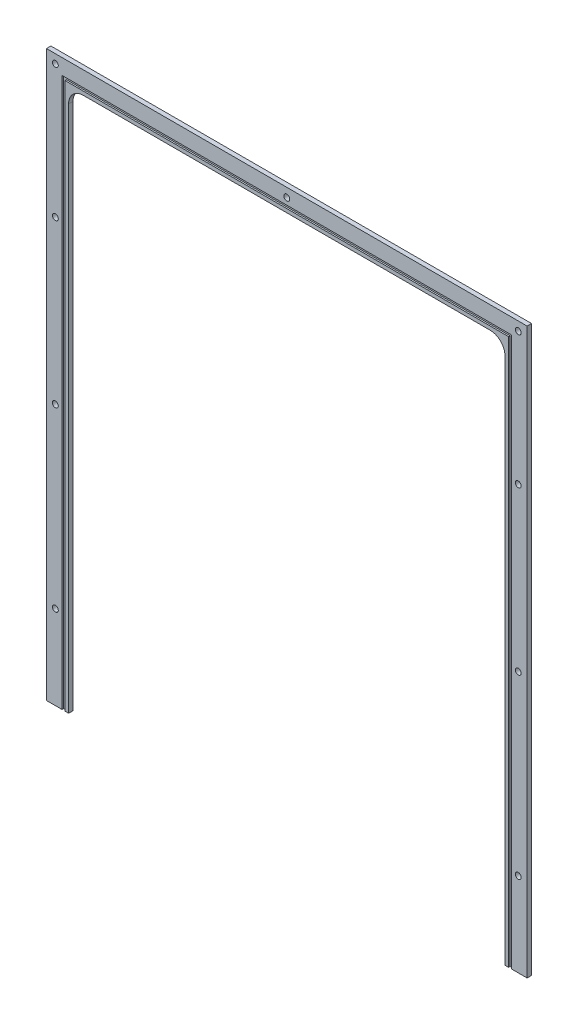
from build123d import *

# Parameters (mm, degrees)
SKETCH1_R           = 2
BOSS_EXTRUDE1_DEPTH = 3
GROOVE_DEPTH        = 1


with BuildPart() as part:
    # Sketch1 → Boss-Extrude1 (new body)
    with BuildSketch(Plane.XY):
        with BuildLine():
            Line((163, 193), (-163, 193))
            Line((-163, 193), (-163, -190))
            Line((-163, -190), (-148, -190))
            Line((-148, -190), (-148, -173))
            Line((-148, -173), (-148, 168))
            ThreePointArc((-148, 168), (-145.071067812, 175.071067812), (-138, 178))
            Line((-138, 178), (138, 178))
            ThreePointArc((138, 178), (145.071067812, 175.071067812), (148, 168))
            Line((148, 168), (148, -173))
            Line((148, -173), (148, -190))
            Line((148, -190), (163, -190))
            Line((163, -190), (163, 193))
        make_face()
        with Locations((-157, -133)):
            Circle(SKETCH1_R, mode=Mode.SUBTRACT)
        with Locations((-157, -13)):
            Circle(SKETCH1_R, mode=Mode.SUBTRACT)
        with Locations((157, -133)):
            Circle(SKETCH1_R, mode=Mode.SUBTRACT)
        with Locations((157, -13)):
            Circle(SKETCH1_R, mode=Mode.SUBTRACT)
        with Locations((-157, 97)):
            Circle(SKETCH1_R, mode=Mode.SUBTRACT)
        with Locations((-157, 187)):
            Circle(SKETCH1_R, mode=Mode.SUBTRACT)
        with Locations((0, 187)):
            Circle(SKETCH1_R, mode=Mode.SUBTRACT)
        with Locations((157, 97)):
            Circle(SKETCH1_R, mode=Mode.SUBTRACT)
        with Locations((157, 187)):
            Circle(SKETCH1_R, mode=Mode.SUBTRACT)
    extrude(amount=BOSS_EXTRUDE1_DEPTH)

    # Sketch2 → Groove (cut)
    with BuildSketch(Plane.XY.offset(3)):
        Polygon((-152.5, -190), (-150.5, -190), (-150.5, 180.5), (150.5, 180.5), (150.5, -190), (152.5, -190), (152.5, 182.5), (-152.5, 182.5), align=None)
    extrude(amount=-GROOVE_DEPTH, mode=Mode.SUBTRACT)


solid = part.part
